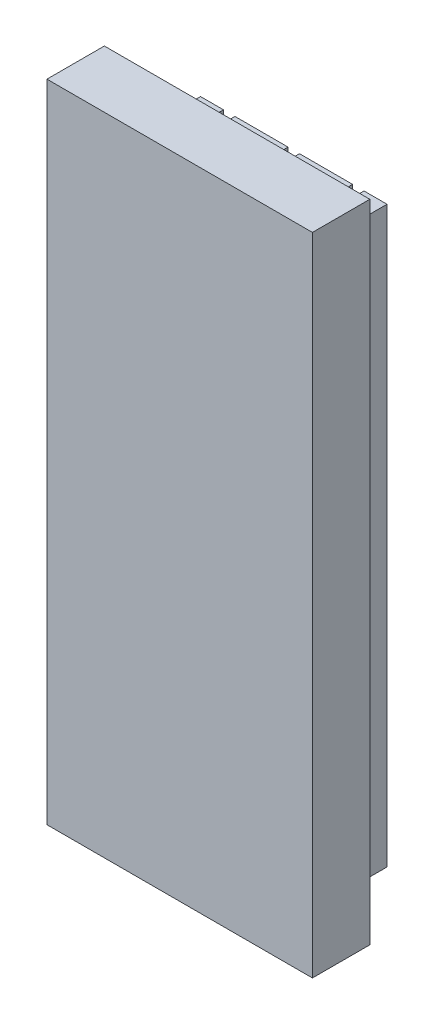
from build123d import *

# Parameters (mm, degrees)
BOSS_EXTRUDE1_DEPTH      = 800
BOSS_EXTRUDE2_DEPTH      = 50
BOSS_EXTRUDE2_DEPTH_BACK = 850
SKETCH2_W                = 370
SKETCH2_H                = 80


with BuildPart() as part:
    # Sketch1 → Boss-Extrude1 (new body)
    with BuildSketch(Plane(origin=(0, 0, 0), x_dir=(1, 0, 0), z_dir=(0, 1, 0))):
        Polygon((-228, 90), (-260, 90), (-260, 0), (0, 0), (0, 90), (-32, 90), (-32, 81), (-24, 81), (-24, 72), (-56, 72), (-56, 81), (-48, 81), (-48, 90), (-122, 90), (-122, 81), (-114, 81), (-114, 72), (-146, 72), (-146, 81), (-138, 81), (-138, 90), (-212, 90), (-212, 81), (-204, 81), (-204, 72), (-236, 72), (-236, 81), (-228, 81), align=None)
    extrude(amount=BOSS_EXTRUDE1_DEPTH)

    # Sketch2 → Boss-Extrude2 (add, two sides: drawn at the far end of the back side and taken through both)
    with BuildSketch(Plane.XZ.offset(-BOSS_EXTRUDE2_DEPTH_BACK)):
        with Locations((-153, 6)):
            Rectangle(SKETCH2_W, SKETCH2_H)
    extrude(amount=BOSS_EXTRUDE2_DEPTH + BOSS_EXTRUDE2_DEPTH_BACK)


solid = part.part
